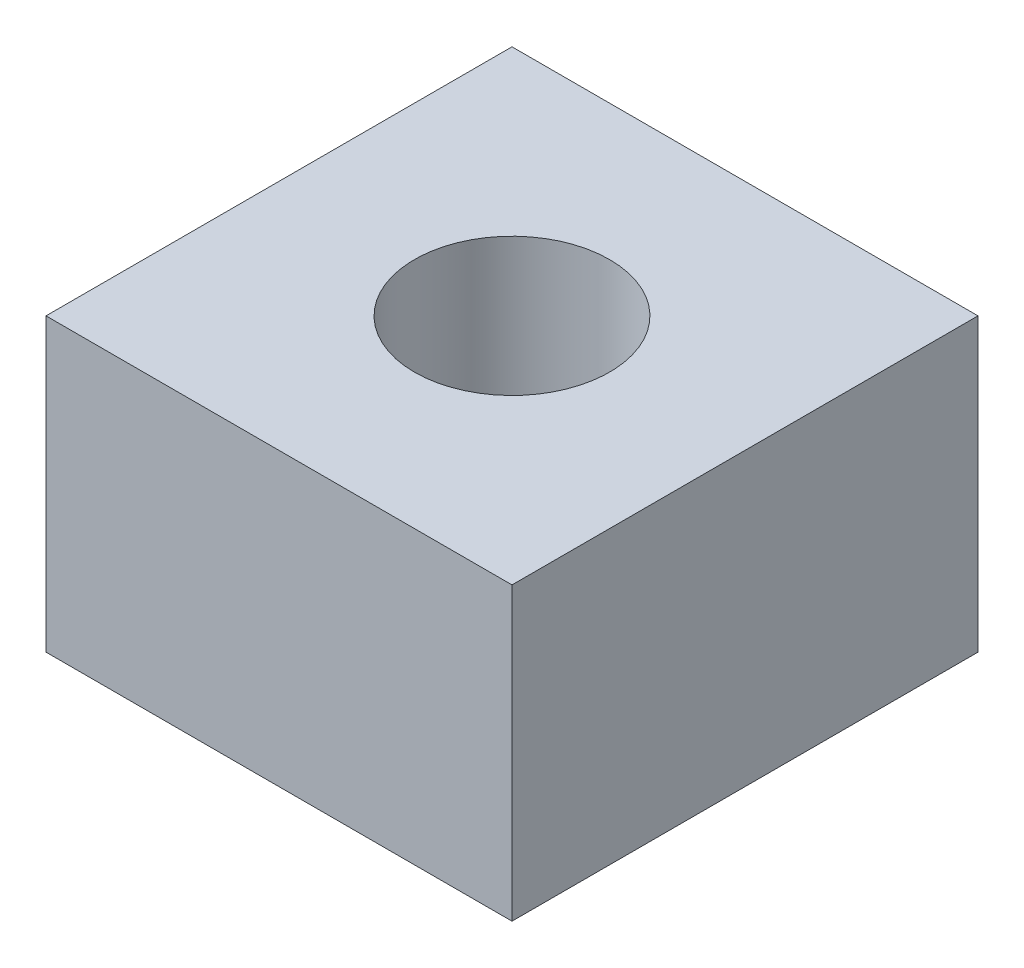
from build123d import *

# Parameters (mm, degrees)
SKETCH2_R           = 1.675
BOSS_EXTRUDE1_DEPTH = 5


with BuildPart() as part:
    # Sketch2 → Boss-Extrude1 (new body)
    with BuildSketch(Plane(origin=(0, 0, 0), x_dir=(1, 0, 0), z_dir=(0, 1, 0))):
        Polygon((4.470763245, 9.399437104), (4.470763245, 13.399437104), (4.470763245, 17.399437104), (12.470763245, 17.399437104), (12.470763245, 13.399437104), (12.470763245, 9.399437104), align=None)
        with Locations(Location((8.470763245, 13.399437104, 0), (0, 0, 270))):
            Circle(SKETCH2_R, mode=Mode.SUBTRACT)
    extrude(amount=BOSS_EXTRUDE1_DEPTH)


solid = part.part
